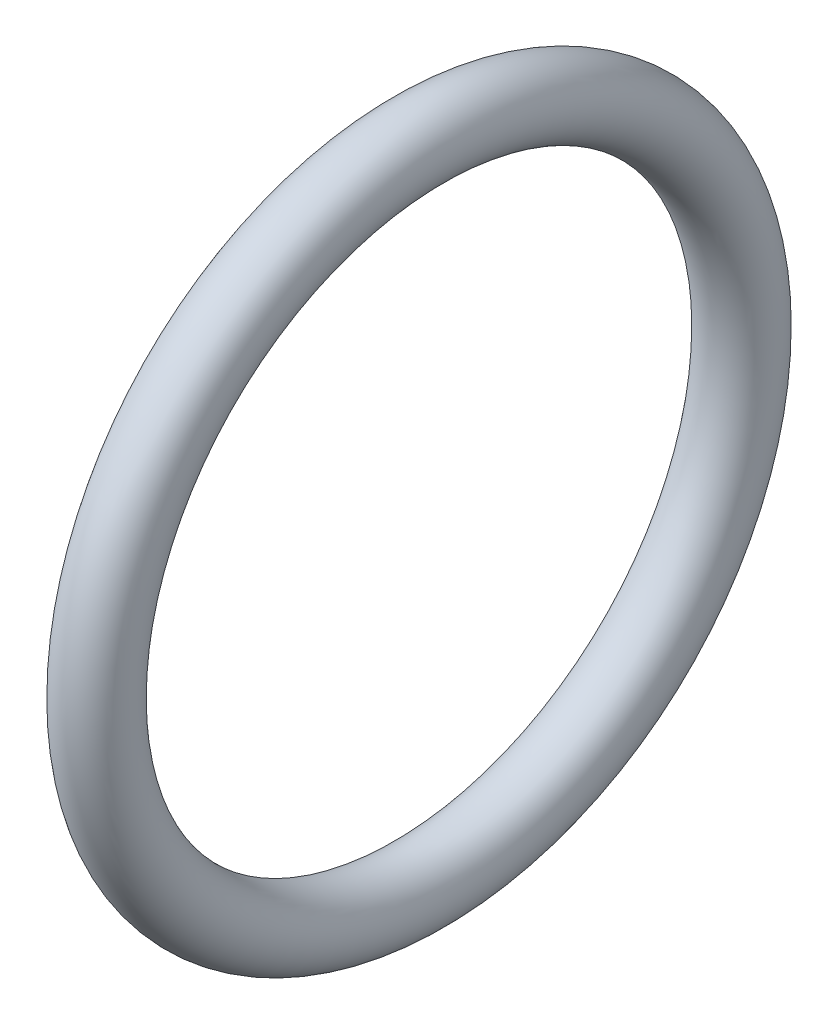
from build123d import *

# Parameters (mm, degrees)
SKETCH1_R = 1.5


with BuildPart() as part:
    # Sketch1 → Revolve1 (revolve)
    with BuildSketch(Plane.XY, mode=Mode.PRIVATE) as revolve1_sk:
        with Locations((0, 13.75)):
            Circle(SKETCH1_R)
    revolve(revolve1_sk.sketch.rotate(Axis((-1.5, 0, 0), (1, 0, 0)), 90), axis=Axis((-1.5, 0, 0), (1, 0, 0)))


solid = part.part
